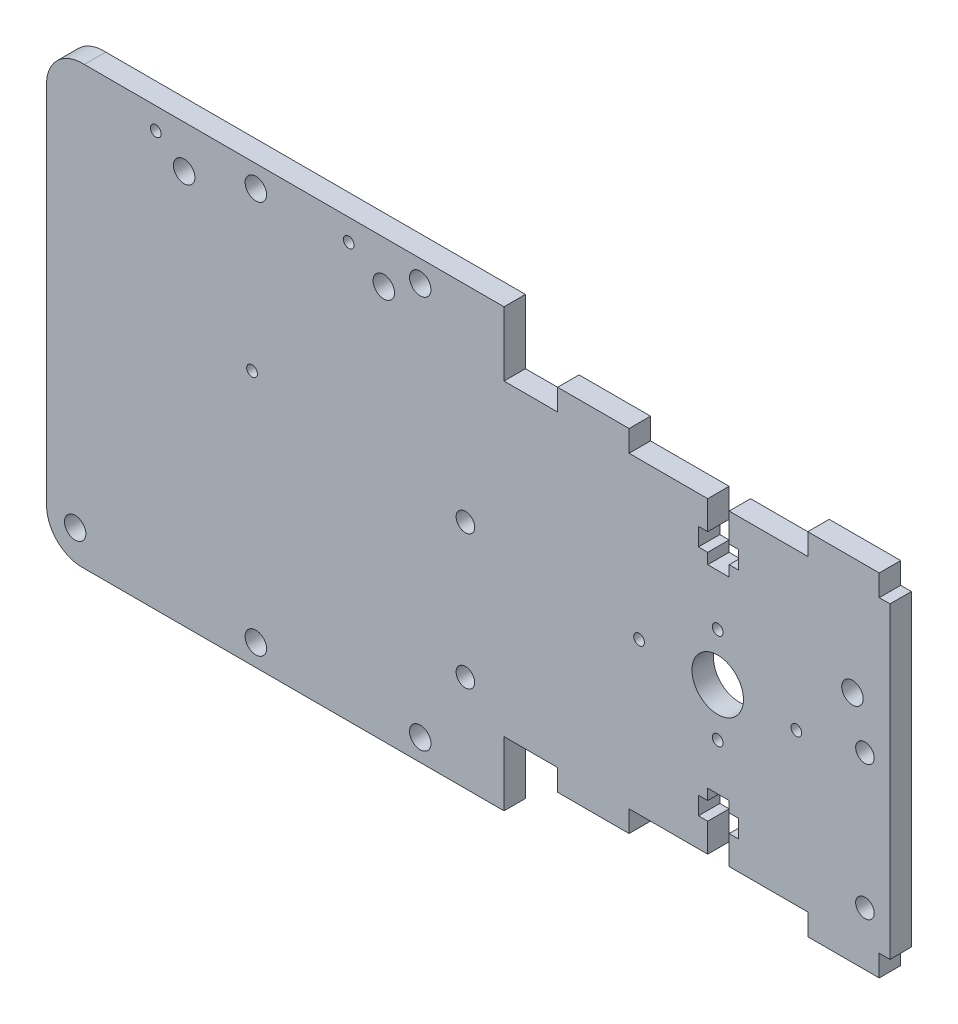
from build123d import *

# Parameters (mm, degrees)
SKETCH_1_R      = 1.3
SKETCH_1_R_2    = 1.500000002
SKETCH_1_R_3    = 0.75
SKETCH_1_R_4    = 1.5
SKETCH_1_R_5    = 3.600000001
EXTRUDE_1_DEPTH = 3


with BuildPart() as part:
    # 草圖1 → 填料-伸長1 (new body)
    with BuildSketch(Plane.XY):
        with BuildLine():
            Line((215.998800526, 63.986947452), (215.998800526, 54.986947452))
            Line((215.998800526, 54.986947452), (223.498800526, 54.986947452))
            Line((223.498800526, 54.986947452), (223.498800526, 57.986947452))
            Line((223.498800526, 57.986947452), (233.498800526, 57.986947452))
            Line((233.498800526, 57.986947452), (233.498800526, 54.986947452))
            Line((233.498800526, 54.986947452), (244.498800526, 54.986947452))
            Line((244.498800526, 54.986947452), (244.498800526, 50.987047452))
            Line((244.498800526, 50.987047452), (243.198800526, 50.987047452))
            Line((243.198800526, 50.987047452), (243.198800526, 48.487047452))
            Line((243.198800526, 48.487047452), (244.498800526, 48.487047452))
            Line((244.498800526, 48.487047452), (244.498800526, 46.986947452))
            Line((244.498800526, 46.986947452), (247.498800526, 46.986947452))
            Line((247.498800526, 46.986947452), (247.498800526, 48.487047452))
            Line((247.498800526, 48.487047452), (248.798800526, 48.487047452))
            Line((248.798800526, 48.487047452), (248.798800526, 50.987047452))
            Line((248.798800526, 50.987047452), (247.498800526, 50.987047452))
            Line((247.498800526, 50.987047452), (247.498800526, 54.986947452))
            Line((247.498800526, 54.986947452), (258.498800526, 54.986947452))
            Line((258.498800526, 54.986947452), (258.498800526, 57.986947452))
            Line((258.498800526, 57.986947452), (268.498800526, 57.986947452))
            Line((268.498800526, 57.986947452), (268.498800526, 54.986947452))
            Line((268.498800526, 54.986947452), (269.998800526, 54.986947452))
            Line((269.998800526, 54.986947452), (269.998800526, 11.906947452))
            Line((269.998800526, 11.906947452), (268.498800526, 11.906947452))
            Line((268.498800526, 11.906947452), (268.498800526, 8.906947452))
            Line((268.498800526, 8.906947452), (258.498800526, 8.906947452))
            Line((258.498800526, 8.906947452), (258.498800526, 11.906947452))
            Line((258.498800526, 11.906947452), (247.498800526, 11.906947452))
            Line((247.498800526, 11.906947452), (247.498800526, 15.906947452))
            Line((247.498800526, 15.906947452), (248.798800526, 15.906947452))
            Line((248.798800526, 15.906947452), (248.798800526, 18.406947452))
            Line((248.798800526, 18.406947452), (247.498800526, 18.406947452))
            Line((247.498800526, 18.406947452), (247.498800526, 19.906947452))
            Line((247.498800526, 19.906947452), (244.498800526, 19.906947452))
            Line((244.498800526, 19.906947452), (244.498800526, 18.406947452))
            Line((244.498800526, 18.406947452), (243.198800526, 18.406947452))
            Line((243.198800526, 18.406947452), (243.198800526, 15.906947452))
            Line((243.198800526, 15.906947452), (244.498800526, 15.906947452))
            Line((244.498800526, 15.906947452), (244.498800526, 11.906947452))
            Line((244.498800526, 11.906947452), (233.498800526, 11.906947452))
            Line((233.498800526, 11.906947452), (233.498800526, 8.906947452))
            Line((233.498800526, 8.906947452), (223.498800526, 8.906947452))
            Line((223.498800526, 8.906947452), (223.498800526, 11.906947452))
            Line((223.498800526, 11.906947452), (215.998800526, 11.906947452))
            Line((215.998800526, 11.906947452), (215.998800526, 2.906947452))
            Line((215.998800526, 2.906947452), (157.278776491, 2.906947452))
            ThreePointArc((157.278776491, 2.906947452), (153.564569232, 4.266490303), (152.0002, 7.899180934))
            Line((152.0002, 7.899180934), (152.0002, 59.281989405))
            ThreePointArc((152.0002, 59.281989405), (153.665059528, 62.727697415), (157.278776491, 63.986947452))
            Line((157.278776491, 63.986947452), (215.998800526, 63.986947452))
        make_face()
        with Locations((266.498800526, 16.406947452)):
            Circle(SKETCH_1_R, mode=Mode.SUBTRACT)
        with Locations((264.748800526, 41.606947452)):
            Circle(SKETCH_1_R_2, mode=Mode.SUBTRACT)
        with Locations((266.498800526, 35.206947452)):
            Circle(SKETCH_1_R, mode=Mode.SUBTRACT)
        with Locations((256.898805336, 33.13699656)):
            Circle(SKETCH_1_R_3, mode=Mode.SUBTRACT)
        with Locations((245.898805336, 39.836947452)):
            Circle(SKETCH_1_R_3, mode=Mode.SUBTRACT)
        with Locations((245.898805336, 26.436947452)):
            Circle(SKETCH_1_R_3, mode=Mode.SUBTRACT)
        with Locations((234.898744394, 33.126641893)):
            Circle(SKETCH_1_R_3, mode=Mode.SUBTRACT)
        with Locations((155.997377017, 7.216947452)):
            Circle(SKETCH_1_R_4, mode=Mode.SUBTRACT)
        with Locations((181.277377017, 5.946947452)):
            Circle(SKETCH_1_R_4, mode=Mode.SUBTRACT)
        with Locations((204.277377017, 5.946947452)):
            Circle(SKETCH_1_R_4, mode=Mode.SUBTRACT)
        with Locations((210.598800526, 16.406947452)):
            Circle(SKETCH_1_R, mode=Mode.SUBTRACT)
        with Locations((210.598800526, 35.206947452)):
            Circle(SKETCH_1_R, mode=Mode.SUBTRACT)
        with Locations((180.744327914, 38.596947452)):
            Circle(SKETCH_1_R_3, mode=Mode.SUBTRACT)
        with Locations((204.277377017, 60.946947452)):
            Circle(SKETCH_1_R_4, mode=Mode.SUBTRACT)
        with Locations((199.177377017, 58.016947452)):
            Circle(SKETCH_1_R_4, mode=Mode.SUBTRACT)
        with Locations((194.277377017, 60.946947452)):
            Circle(SKETCH_1_R_3, mode=Mode.SUBTRACT)
        with Locations((181.277377017, 60.946947452)):
            Circle(SKETCH_1_R_4, mode=Mode.SUBTRACT)
        with Locations((167.277377017, 60.946947452)):
            Circle(SKETCH_1_R_3, mode=Mode.SUBTRACT)
        with Locations((171.247377017, 58.016947452)):
            Circle(SKETCH_1_R_4, mode=Mode.SUBTRACT)
        with Locations((245.898805335, 33.13699656)):
            Circle(SKETCH_1_R_5, mode=Mode.SUBTRACT)
    extrude(amount=EXTRUDE_1_DEPTH)


solid = part.part
